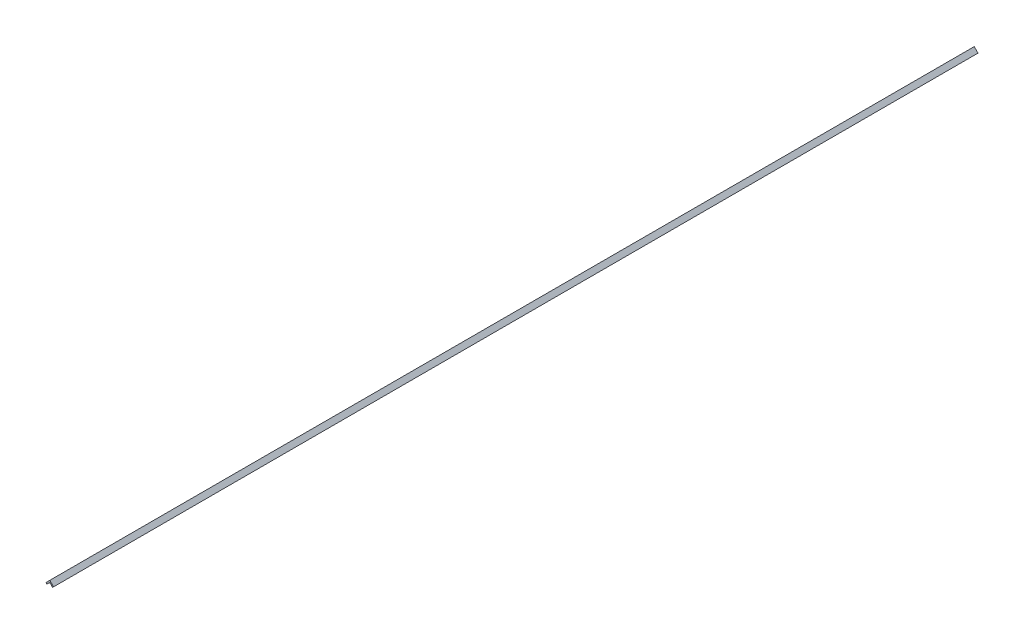
from build123d import *

# Parameters (mm, degrees)
RESSALTO_EXTRUS_O1_DEPTH = 2200


with BuildPart() as part:
    # Esboço1 → Ressalto-extrusão1 (new body)
    with BuildSketch(Plane.XY):
        Polygon((0, 11.228855685), (8.980256121, 2.248599564), (6.731656557, 0), (0, 6.731656557), (-6.731656557, 0), (-8.980256121, 2.248599564), align=None)
    extrude(amount=RESSALTO_EXTRUS_O1_DEPTH)


solid = part.part
